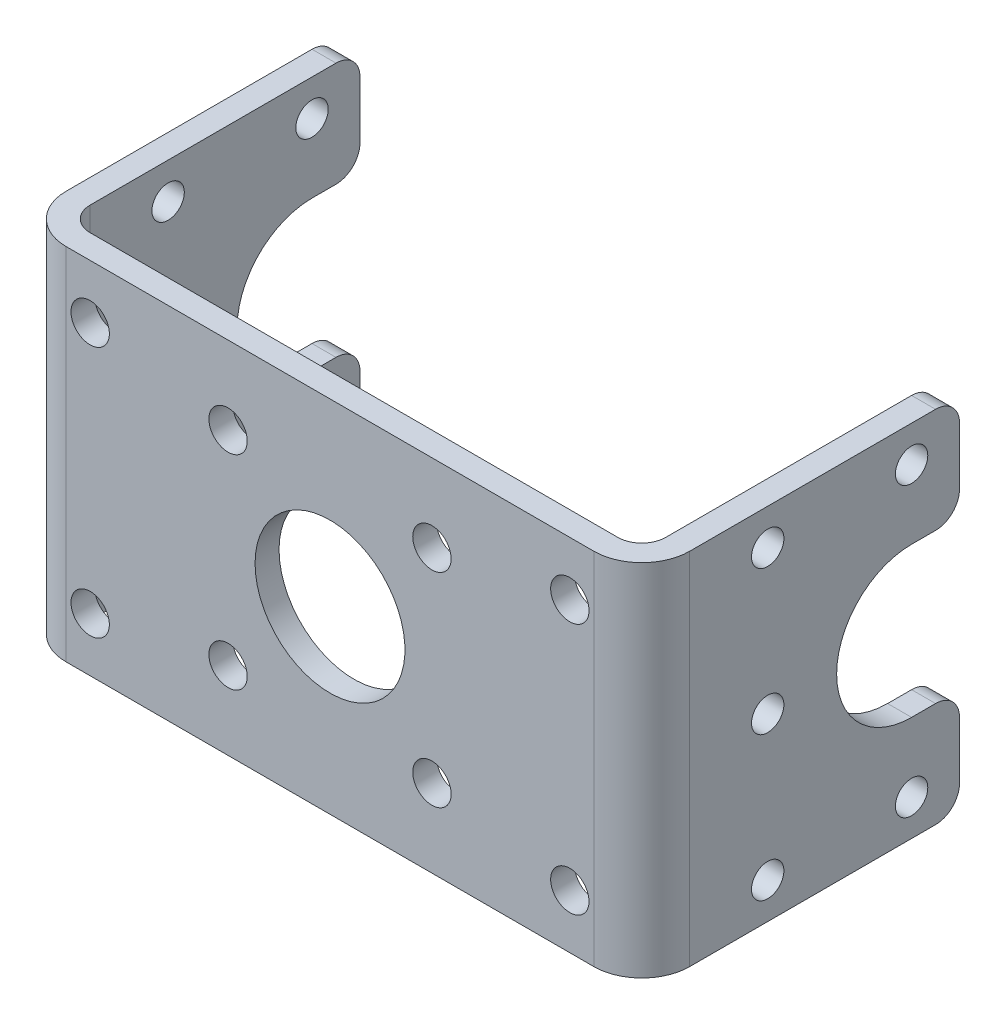
from build123d import *

# Parameters (mm, degrees)
EXTRUDE_1_DEPTH     = 15
SKETCH_2_R          = 1.6
SKETCH_2_R_2        = 6.25
CUT_EXTRUDE_1_DEPTH = 2
SKETCH_3_R          = 1.35
CUT_EXTRUDE_2_DEPTH = 31.5
FILLET_1_R          = 2


with BuildPart() as part:
    # 草图1 → 凸台-拉伸1 (new, symmetric)
    with BuildSketch(Plane(origin=(0, 0, 0), x_dir=(1, 0, 0), z_dir=(0, 1, 0))):
        with BuildLine():
            Line((0, 0), (22, 0))
            ThreePointArc((22, 0), (24.828427125, 1.171572875), (26, 4))
            Line((26, 4), (26, 26.5))
            Line((26, 26.5), (24, 26.5))
            Line((24, 26.5), (24, 4))
            ThreePointArc((24, 4), (23.414213562, 2.585786438), (22, 2))
            Line((22, 2), (0, 2))
            Line((0, 2), (-22, 2))
            ThreePointArc((-22, 2), (-23.414213562, 2.585786438), (-24, 4))
            Line((-24, 4), (-24, 26.5))
            Line((-24, 26.5), (-26, 26.5))
            Line((-26, 26.5), (-26, 4))
            ThreePointArc((-26, 4), (-24.828427125, 1.171572875), (-22, 0))
            Line((-22, 0), (0, 0))
        make_face()
    extrude(amount=EXTRUDE_1_DEPTH, both=True)

    # 草图2 → 切除-拉伸1 (cut)
    with BuildSketch(Plane(origin=(0, 0, -2), x_dir=(-1, 0, 0), z_dir=(0, 0, -1))):
        with Locations((20, 10.5)):
            Circle(SKETCH_2_R)
        with Locations((8.5, 8.5)):
            Circle(SKETCH_2_R)
        with Locations((-8.5, 8.5)):
            Circle(SKETCH_2_R)
        with Locations((-20, 10.5)):
            Circle(SKETCH_2_R)
        with Locations((-20, -10.5)):
            Circle(SKETCH_2_R)
        with Locations((8.5, -8.5)):
            Circle(SKETCH_2_R)
        with Locations((-8.5, -8.5)):
            Circle(SKETCH_2_R)
        with Locations((20, -10.5)):
            Circle(SKETCH_2_R)
        Circle(SKETCH_2_R_2)
    extrude(amount=-CUT_EXTRUDE_1_DEPTH, mode=Mode.SUBTRACT)

    # 草图3 → 切除-拉伸2 (cut, symmetric)
    with BuildSketch(Plane(origin=(0, 0, 0), x_dir=(0, 0, -1), z_dir=(1, 0, 0))):
        with Locations((10.5, 12)):
            Circle(SKETCH_3_R)
        with Locations((22.5, 12)):
            Circle(SKETCH_3_R)
        with Locations((10.5, 0)):
            Circle(SKETCH_3_R)
        with Locations((22.5, -12)):
            Circle(SKETCH_3_R)
        with Locations((10.5, -12)):
            Circle(SKETCH_3_R)
        with BuildLine():
            Line((22.5, 6.25), (26.5, 6.25))
            Line((26.5, 6.25), (26.5, -6.25))
            Line((26.5, -6.25), (22.5, -6.25))
            ThreePointArc((22.5, -6.25), (16.25, 0), (22.5, 6.25))
        make_face()
    extrude(amount=CUT_EXTRUDE_2_DEPTH, both=True, mode=Mode.SUBTRACT)

    # 圆角1
    fillet_1_edges = [part.edges().sort_by_distance(p)[0] for p in [
        (-25, 6.25, -26.5),
        (25, 6.25, -26.5),
        (-25, -6.25, -26.5),
        (25, -6.25, -26.5),
        (25, -15, -26.5),
        (-25, -15, -26.5),
        (-25, 15, -26.5),
        (25, 15, -26.5),
    ]]
    fillet(fillet_1_edges, radius=FILLET_1_R)


solid = part.part
